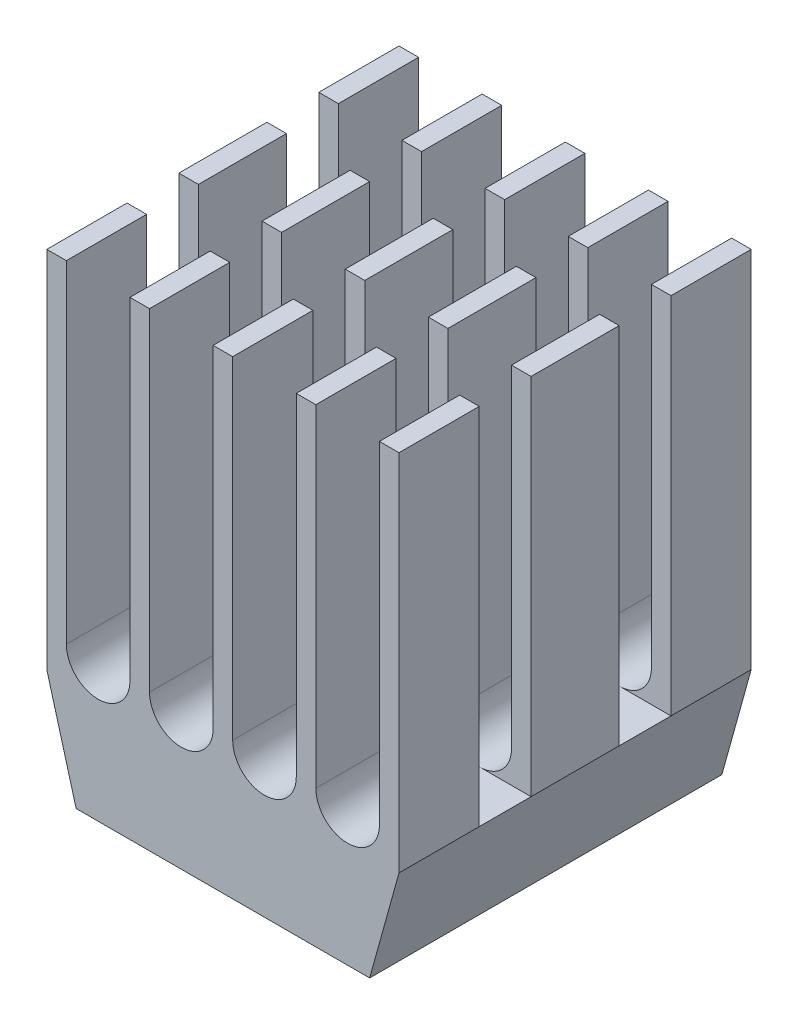
from build123d import *

# Parameters (mm, degrees)
AUFSATZ_LINEAR_AUSTRAGEN1_DEPTH = 4.5
SCHNITT_LINEAR_AUSTRAGEN1_DEPTH = 9
SCHNITT_LINEAR_AUSTRAGEN2_REACH = 17.66
SKIZZE3_W                       = 1.325
SKIZZE3_H                       = 9.3
SKIZZE4_W                       = 7.3
SKIZZE4_H                       = 8.8
AUFSATZ_LINEAR_AUSTRAGEN2_DEPTH = 0.1


with BuildPart() as part:
    # Skizze1 → Aufsatz-Linear austragen1 (new, symmetric)
    with BuildSketch(Plane.XY):
        Polygon((-4.5, 12), (-4.5, 2.7), (-3.75, 0), (3.75, 0), (4.5, 2.7), (4.5, 12), align=None)
    extrude(amount=AUFSATZ_LINEAR_AUSTRAGEN1_DEPTH, both=True)

    # Skizze2 → Schnitt-Linear austragen1 (cut)
    with BuildSketch(Plane.XY.offset(4.5)):
        with BuildLine():
            Line((-2.375, 12), (-2.375, 3.5125))
            ThreePointArc((-2.375, 3.5125), (-3.1875, 2.7), (-4, 3.5125))
            Line((-4, 3.5125), (-4, 12))
            ThreePointArc((-4, 12), (-3.1875, 12.8125), (-2.375, 12))
        make_face()
        with BuildLine():
            Line((-0.25, 12), (-0.25, 3.5125))
            ThreePointArc((-0.25, 3.5125), (-1.0625, 2.7), (-1.875, 3.5125))
            Line((-1.875, 3.5125), (-1.875, 12))
            ThreePointArc((-1.875, 12), (-1.0625, 12.8125), (-0.25, 12))
        make_face()
        with BuildLine():
            Line((1.875, 12), (1.875, 3.5125))
            ThreePointArc((1.875, 3.5125), (1.0625, 2.7), (0.25, 3.5125))
            Line((0.25, 3.5125), (0.25, 12))
            ThreePointArc((0.25, 12), (1.0625, 12.8125), (1.875, 12))
        make_face()
        with BuildLine():
            Line((4, 12), (4, 3.5125))
            ThreePointArc((4, 3.5125), (3.1875, 2.7), (2.375, 3.5125))
            Line((2.375, 3.5125), (2.375, 12))
            ThreePointArc((2.375, 12), (3.1875, 12.8125), (4, 12))
        make_face()
    extrude(amount=-SCHNITT_LINEAR_AUSTRAGEN1_DEPTH, mode=Mode.SUBTRACT)

    # Schnitt-Linear austragen2: up to this face of the body (flat: up to its plane)
    schnitt_linear_austragen2_end = Plane(part.part.faces().sort_by_distance((-4.5, 7.35, 0))[0])
    # Skizze3 → Schnitt-Linear austragen2 (cut, up to the picked face)
    with BuildSketch(Plane(origin=(4.5, 0, 0), x_dir=(0, 0, -1), z_dir=(1, 0, 0)), mode=Mode.PRIVATE) as schnitt_linear_austragen2_sk1:
        with Locations((-1.7875, 7.35)):
            Rectangle(SKIZZE3_W, SKIZZE3_H)
    schnitt_linear_austragen2_tool1 = split(extrude(schnitt_linear_austragen2_sk1.sketch, amount=-SCHNITT_LINEAR_AUSTRAGEN2_REACH, mode=Mode.PRIVATE), bisect_by=schnitt_linear_austragen2_end, keep=Keep.BOTH, mode=Mode.PRIVATE)
    # Skizze3 → Schnitt-Linear austragen2 (cut, up to the picked face)
    with BuildSketch(Plane(origin=(4.5, 0, 0), x_dir=(0, 0, -1), z_dir=(1, 0, 0)), mode=Mode.PRIVATE) as schnitt_linear_austragen2_sk2:
        with Locations((1.7875, 7.35)):
            Rectangle(SKIZZE3_W, SKIZZE3_H)
    schnitt_linear_austragen2_tool2 = split(extrude(schnitt_linear_austragen2_sk2.sketch, amount=-SCHNITT_LINEAR_AUSTRAGEN2_REACH, mode=Mode.PRIVATE), bisect_by=schnitt_linear_austragen2_end, keep=Keep.BOTH, mode=Mode.PRIVATE)
    add(schnitt_linear_austragen2_tool1.solids().sort_by(Axis((4.5, 7.35, 1.7875), (-1, 0, 0)))[0], mode=Mode.SUBTRACT)
    add(schnitt_linear_austragen2_tool2.solids().sort_by(Axis((4.5, 7.35, -1.7875), (-1, 0, 0)))[0], mode=Mode.SUBTRACT)

    # Skizze4 → Aufsatz-Linear austragen2 (add)
    with BuildSketch(Plane.XZ):
        Rectangle(SKIZZE4_W, SKIZZE4_H)
    extrude(amount=AUFSATZ_LINEAR_AUSTRAGEN2_DEPTH)


solid = part.part
